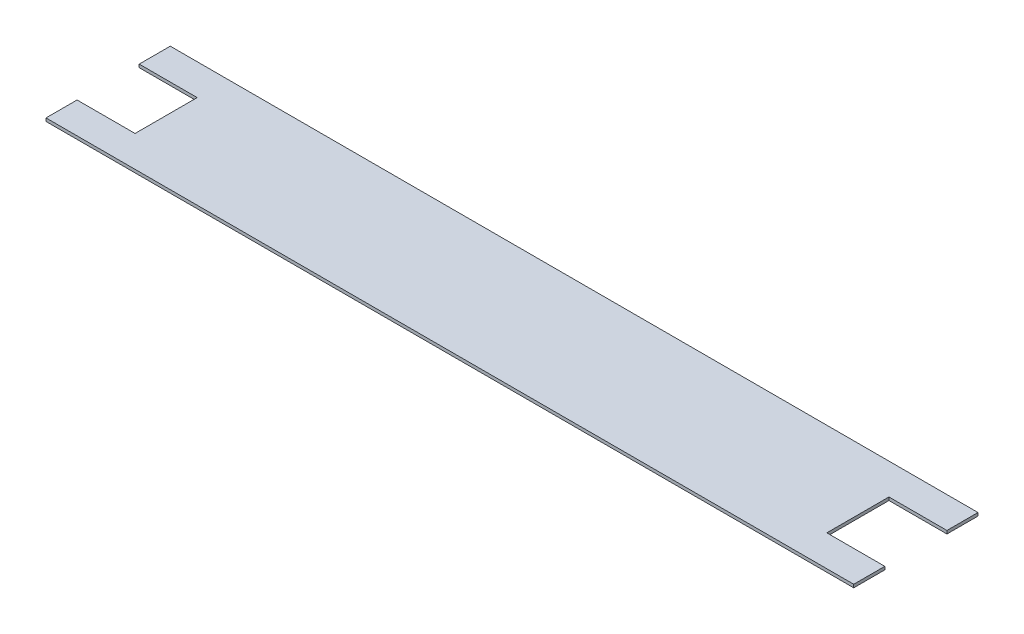
from build123d import *

# Parameters (mm, degrees)
EXTRUDE_1_DEPTH = 1.5


with BuildPart() as part:
    # Эскиз1 → Бобышка-Вытянуть1 (new body)
    with BuildSketch(Plane(origin=(0, 0, 0), x_dir=(1, 0, 0), z_dir=(0, 1, 0))):
        Polygon((0, 0), (0, 15), (28, 15), (28, 45), (0, 45), (0, 60), (390, 60), (390, 45), (362, 45), (362, 15), (390, 15), (390, 0), align=None)
    extrude(amount=EXTRUDE_1_DEPTH)


solid = part.part
